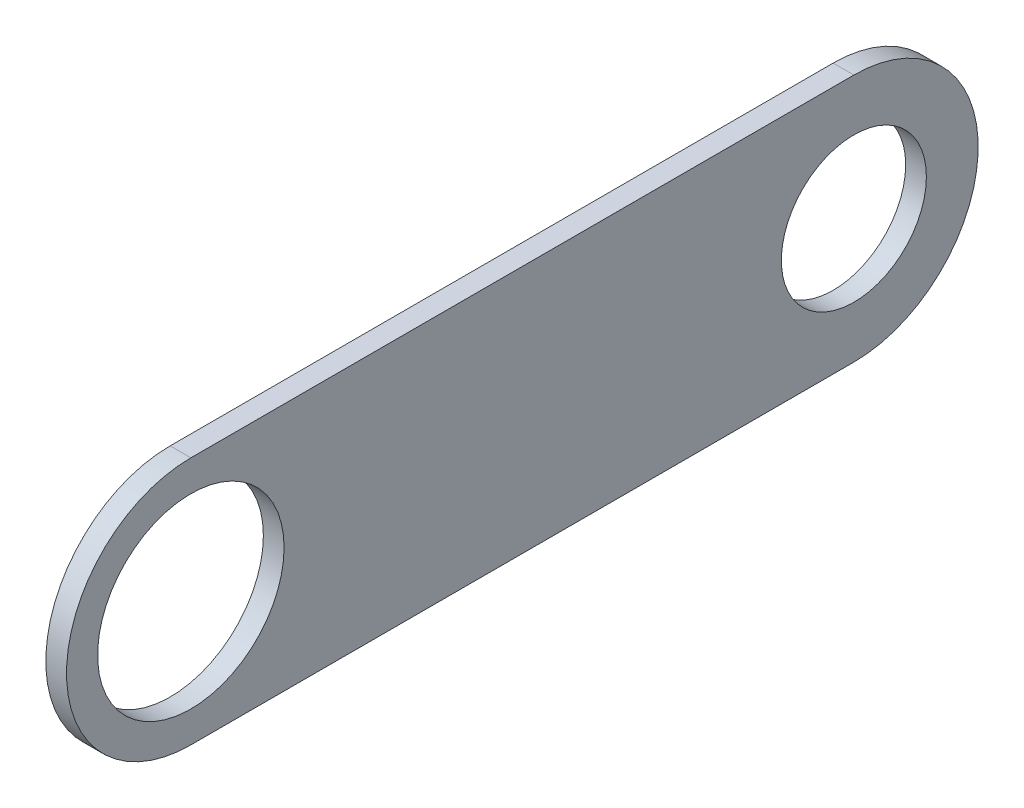
from build123d import *

# Parameters (mm, degrees)
SKETCH1_R           = 14.2875
SKETCH1_R_2         = 11.1125
BOSS_EXTRUDE1_DEPTH = 3.175


with BuildPart() as part:
    # Sketch1 → Boss-Extrude1 (new body)
    with BuildSketch(Plane(origin=(0, 0, 0), x_dir=(0, 0, -1), z_dir=(1, 0, 0))):
        with BuildLine():
            Line((-50.8, 19.05), (50.8, 19.05))
            ThreePointArc((50.8, 19.05), (69.85, 0), (50.8, -19.05))
            Line((50.8, -19.05), (-50.8, -19.05))
            ThreePointArc((-50.8, -19.05), (-69.85, 0), (-50.8, 19.05))
        make_face()
        with Locations((-50.8, 0)):
            Circle(SKETCH1_R, mode=Mode.SUBTRACT)
        with Locations((50.8, 0)):
            Circle(SKETCH1_R_2, mode=Mode.SUBTRACT)
    extrude(amount=BOSS_EXTRUDE1_DEPTH)


solid = part.part
